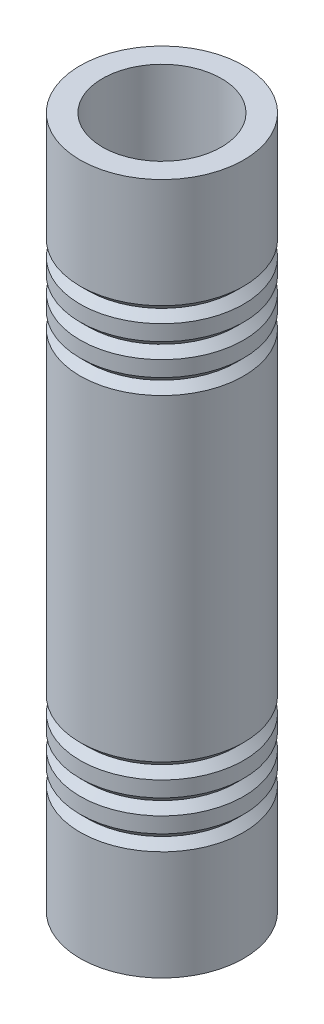
from build123d import *


with BuildPart() as part:
    # Sketch1 → Revolve1 (revolve)
    with BuildSketch(Plane(origin=(0, 0, 0), x_dir=(-1, 0, 0), z_dir=(0, 0, -1)), mode=Mode.PRIVATE) as revolve1_sk:
        Polygon((-15.2908, 177.8), (-21.034375, 177.8), (-21.034375, 149.7), (-19.034375, 147.7), (-21.034375, 145.7), (-21.034375, 141.7), (-19.034375, 139.7), (-21.034375, 137.7), (-21.034375, 133.7), (-19.034375, 131.7), (-21.034375, 129.7), (-21.034375, 88.9), (-21.034375, 48.1), (-19.034375, 46.1), (-21.034375, 44.1), (-21.034375, 40.1), (-19.034375, 38.1), (-21.034375, 36.1), (-21.034375, 32.1), (-19.034375, 30.1), (-21.034375, 28.1), (-21.034375, 0), (-15.2908, 0), align=None)
    revolve(revolve1_sk.sketch.rotate(Axis((0, 0, 0), (0, 1, 0)), 270), axis=Axis((0, 0, 0), (0, 1, 0)))


solid = part.part
